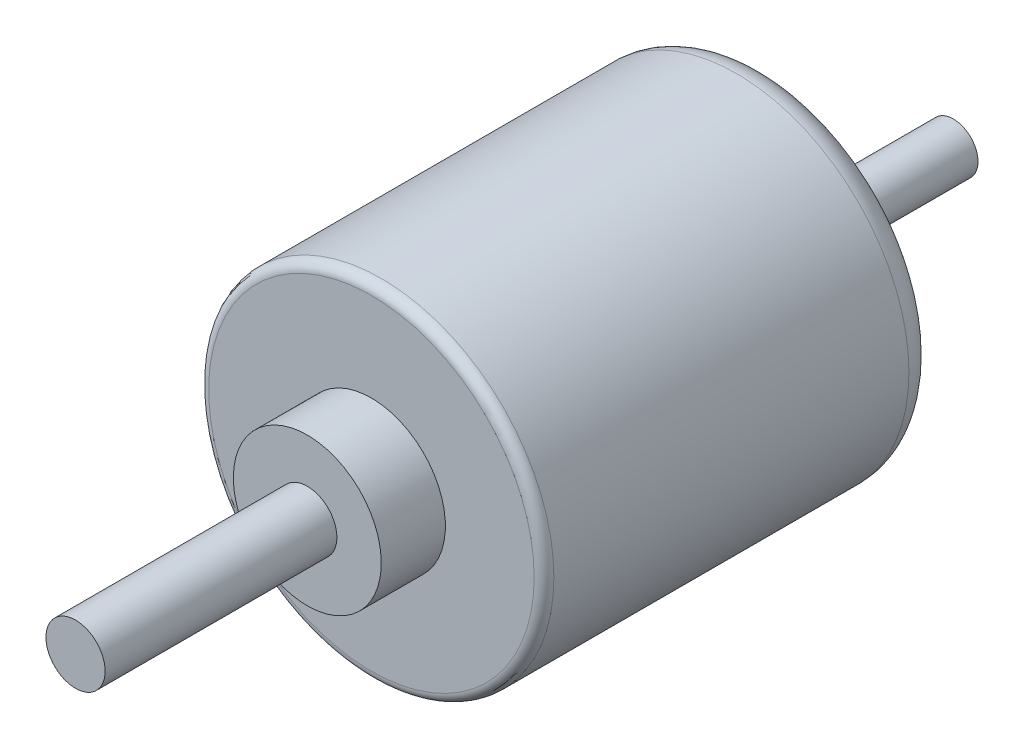
from build123d import *

# Parameters (mm, degrees)
SKETCH1_R           = 17.5
BOSS_EXTRUDE2_DEPTH = 40
SKETCH1_3_R         = 2.5
BOSS_EXTRUDE3_DEPTH = 19
SKETCH1_4_R         = 5.5
BOSS_EXTRUDE4_DEPTH = 42
SKETCH1_5_R         = 3
BOSS_EXTRUDE5_DEPTH = 70
SKETCH1_6_R         = 7.5
BOSS_EXTRUDE6_DEPTH = 46.5
FILLET1_R           = 1
FILLET2_R           = 3


with BuildPart() as part:
    # Sketch1 → Boss-Extrude2 (new body)
    with BuildSketch(Plane.XY):
        Circle(SKETCH1_R)
    extrude(amount=BOSS_EXTRUDE2_DEPTH)

    # Sketch1<3> → Boss-Extrude3 (add)
    with BuildSketch(Plane.XY):
        Circle(SKETCH1_3_R)
    extrude(amount=-BOSS_EXTRUDE3_DEPTH)

    # Sketch1<4> → Boss-Extrude4 (add)
    with BuildSketch(Plane.XY):
        Circle(SKETCH1_4_R)
    extrude(amount=BOSS_EXTRUDE4_DEPTH)

    # Sketch1<5> → Boss-Extrude5 (add)
    with BuildSketch(Plane.XY):
        Circle(SKETCH1_5_R)
    extrude(amount=BOSS_EXTRUDE5_DEPTH)

    # Sketch1<6> → Boss-Extrude6 (add)
    with BuildSketch(Plane.XY):
        Circle(SKETCH1_6_R)
    extrude(amount=BOSS_EXTRUDE6_DEPTH)

    # Fillet1
    fillet1_edges = [part.edges().sort_by_distance(p)[0] for p in [
        (-17.5, 0, 40),
    ]]
    fillet(fillet1_edges, radius=FILLET1_R)

    # Fillet2
    fillet2_edges = [part.edges().sort_by_distance(p)[0] for p in [
        (-17.5, 0, 0),
    ]]
    fillet(fillet2_edges, radius=FILLET2_R)


solid = part.part
